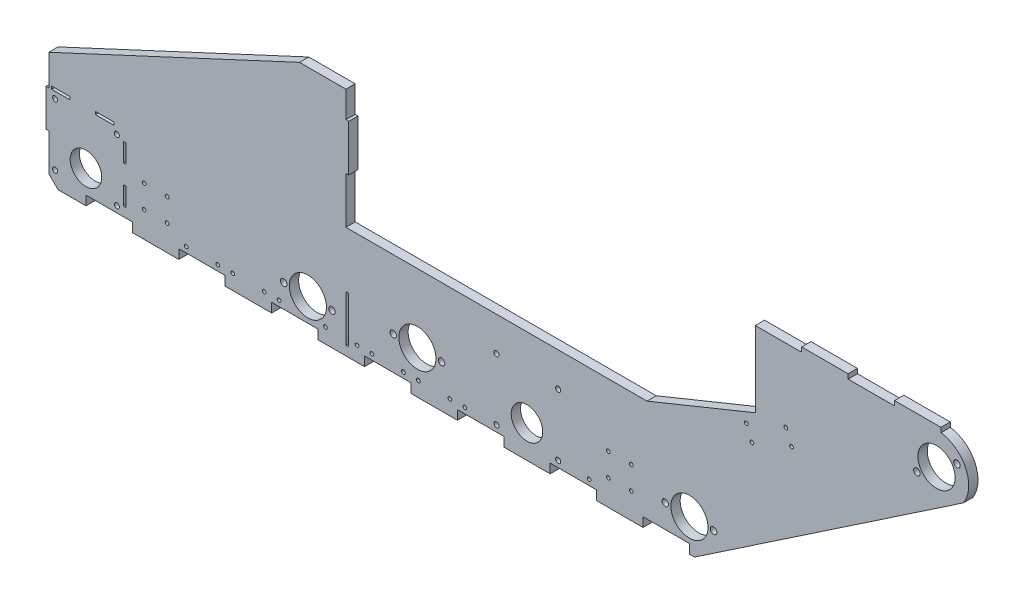
from build123d import *

# Parameters (mm, degrees)
SKETCH_1_R          = 2.75
SKETCH_1_R_2        = 17
SKETCH_1_R_3        = 20
SKETCH_1_R_4        = 3.5
SKETCH_1_R_5        = 2
SKETCH_1_W          = 20
SKETCH_1_H          = 3
SKETCH_1_W_2        = 3.160774411
SKETCH_1_H_2        = 20
SKETCH_1_W_3        = 3
SKETCH_1_H_3        = 50
EXTRUDE_1_DEPTH     = 10
EXTRUDE_3_DEPTH     = 10
SKETCH_3_R          = 2
CUT_EXTRUDE_1_DEPTH = 999.435971659


with BuildPart() as part:
    # 스케치1 → 보스-돌출1 (new body)
    with BuildSketch(Plane.XY):
        with BuildLine():
            Line((5.267585072, -97.655469737), (35.301603788, -97.655469737))
            Line((35.301603788, -97.655469737), (35.301603788, -87.655469737))
            Line((35.301603788, -87.655469737), (85.301603788, -87.655469737))
            Line((85.301603788, -87.655469737), (85.301603788, -97.655469737))
            Line((85.301603788, -97.655469737), (85.305622503, -97.655469737))
            Line((85.305622503, -97.655469737), (135.297585072, -97.655469737))
            Line((135.297585072, -97.655469737), (135.301603788, -97.655469737))
            Line((135.301603788, -97.655469737), (135.301603788, -87.655469737))
            Line((135.301603788, -87.655469737), (185.301603788, -87.655469737))
            Line((185.301603788, -87.655469737), (185.301603788, -97.655469737))
            Line((185.301603788, -97.655469737), (231.531603788, -97.655469737))
            Line((231.531603788, -97.655469737), (235.301603788, -97.655469737))
            Line((235.301603788, -97.655469737), (235.301603788, -87.655469737))
            Line((235.301603788, -87.655469737), (285.301603788, -87.655469737))
            Line((285.301603788, -87.655469737), (285.301603788, -97.655469737))
            Line((285.301603788, -97.655469737), (335.301603788, -97.655469737))
            Line((335.301603788, -97.655469737), (335.301603788, -87.655469737))
            Line((335.301603788, -87.655469737), (385.301603788, -87.655469737))
            Line((385.301603788, -87.655469737), (385.301603788, -97.655469737))
            Line((385.301603788, -97.655469737), (435.301603788, -97.655469737))
            Line((435.301603788, -97.655469737), (435.301603788, -87.655469737))
            Line((435.301603788, -87.655469737), (485.301603788, -87.655469737))
            Line((485.301603788, -87.655469737), (485.301603788, -97.655469737))
            Line((485.301603788, -97.655469737), (535.301603788, -97.655469737))
            Line((535.301603788, -97.655469737), (535.301603788, -87.655469737))
            Line((535.301603788, -87.655469737), (585.301603788, -87.655469737))
            Line((585.301603788, -87.655469737), (585.301603788, -97.655469737))
            Line((585.301603788, -97.655469737), (635.301603788, -97.655469737))
            Line((635.301603788, -97.655469737), (635.301603788, -87.655469737))
            Line((635.301603788, -87.655469737), (685.301603788, -87.655469737))
            Line((685.301603788, -87.655469737), (685.301603788, -97.655469737))
            Line((685.301603788, -97.655469737), (690.631109923, -97.655469737))
            Line((690.631109923, -97.655469737), (980.385244165, 97.7861616))
            ThreePointArc((980.385244165, 97.7861616), (983.008498199, 131.143098655), (956.214221814, 151.183893662))
            Line((956.214221814, 151.183893662), (639.593248415, 22.344530263))
            Line((639.593248415, 22.344530263), (315.301603788, 22.344530263))
            Line((315.301603788, 22.344530263), (315.301603788, 72.661637882))
            Line((315.301603788, 72.661637882), (318.301603788, 72.661637882))
            Line((318.301603788, 72.661637882), (318.301603788, 122.661637882))
            Line((318.301603788, 122.661637882), (315.301603788, 122.661637882))
            Line((315.301603788, 122.661637882), (315.301603788, 146.501001281))
            Line((315.301603788, 146.501001281), (315.301603788, 151.183893662))
            Line((315.301603788, 151.183893662), (265.299669923, 151.183893662))
            Line((265.299669923, 151.183893662), (-4.732414928, 25.58459835))
            Line((-4.732414928, 25.58459835), (-4.732414928, -7.689488453))
            Line((-4.732414928, -7.689488453), (-7.732414928, -7.689488453))
            Line((-7.732414928, -7.689488453), (-7.732414928, -47.689488453))
            Line((-7.732414928, -47.689488453), (-4.732414928, -47.689488453))
            Line((-4.732414928, -47.689488453), (-4.732414928, -87.655469737))
            Line((-4.732414928, -87.655469737), (5.267585072, -97.655469737))
        make_face()
        with Locations((2.067585072, -80.890469737)):
            Circle(SKETCH_1_R, mode=Mode.SUBTRACT)
        with Locations((2.067585072, -14.422432305)):
            Circle(SKETCH_1_R, mode=Mode.SUBTRACT)
        with Locations((68.535622503, -14.422432305)):
            Circle(SKETCH_1_R, mode=Mode.SUBTRACT)
        with Locations((68.535622503, -80.890469737)):
            Circle(SKETCH_1_R, mode=Mode.SUBTRACT)
        with Locations((35.301603788, -62.655469737)):
            Circle(SKETCH_1_R_2, mode=Mode.SUBTRACT)
        with Locations(Location((685.301603788, -62.655469737, 0), (0, 0, 180))):
            Circle(SKETCH_1_R_3, mode=Mode.SUBTRACT)
        with Locations((951.422664578, 116.845452277)):
            Circle(SKETCH_1_R_3, mode=Mode.SUBTRACT)
        with Locations((973.404213264, 130.731110971)):
            Circle(SKETCH_1_R_4, mode=Mode.SUBTRACT)
        with Locations((930.301497775, 101.683120237)):
            Circle(SKETCH_1_R_4, mode=Mode.SUBTRACT)
        with Locations((274.301603788, -62.655469737)):
            Circle(SKETCH_1_R_3, mode=Mode.SUBTRACT)
        with Locations((248.301603788, -62.655469737)):
            Circle(SKETCH_1_R_4, mode=Mode.SUBTRACT)
        with Locations((300.301603788, -62.655469737)):
            Circle(SKETCH_1_R_4, mode=Mode.SUBTRACT)
        with Locations((392.301603788, -51.655469737)):
            Circle(SKETCH_1_R_3, mode=Mode.SUBTRACT)
        with Locations((366.301603788, -51.655469737)):
            Circle(SKETCH_1_R_4, mode=Mode.SUBTRACT)
        with Locations((418.301603788, -51.655469737)):
            Circle(SKETCH_1_R_4, mode=Mode.SUBTRACT)
        with Locations(Location((543.898689933, -14.422432305, 0), (0, 0, 180))):
            Circle(SKETCH_1_R, mode=Mode.SUBTRACT)
        with Locations(Location((477.430652501, -14.422432305, 0), (0, 0, 180))):
            Circle(SKETCH_1_R, mode=Mode.SUBTRACT)
        with Locations(Location((477.430652501, -80.890469737, 0), (0, 0, 180))):
            Circle(SKETCH_1_R, mode=Mode.SUBTRACT)
        with Locations(Location((543.898689933, -80.890469737, 0), (0, 0, 180))):
            Circle(SKETCH_1_R, mode=Mode.SUBTRACT)
        with Locations(Location((510.301603788, -62.655469737, 0), (0, 0, 180))):
            Circle(SKETCH_1_R_2, mode=Mode.SUBTRACT)
        with Locations((659.301603788, -62.655469737)):
            Circle(SKETCH_1_R_4, mode=Mode.SUBTRACT)
        with Locations((711.301603788, -62.655469737)):
            Circle(SKETCH_1_R_4, mode=Mode.SUBTRACT)
        with Locations((143.301603788, -81.655469737)):
            Circle(SKETCH_1_R_5, mode=Mode.SUBTRACT)
        with Locations((177.301603788, -81.655469737)):
            Circle(SKETCH_1_R_5, mode=Mode.SUBTRACT)
        with Locations((193.301603788, -81.655469737)):
            Circle(SKETCH_1_R_5, mode=Mode.SUBTRACT)
        with Locations((227.301603788, -81.655469737)):
            Circle(SKETCH_1_R_5, mode=Mode.SUBTRACT)
        with Locations((243.301603788, -81.655469737)):
            Circle(SKETCH_1_R_5, mode=Mode.SUBTRACT)
        with Locations((293.301603788, -81.655469737)):
            Circle(SKETCH_1_R_5, mode=Mode.SUBTRACT)
        with Locations((327.301603788, -81.655469737)):
            Circle(SKETCH_1_R_5, mode=Mode.SUBTRACT)
        with Locations((343.301603788, -81.655469737)):
            Circle(SKETCH_1_R_5, mode=Mode.SUBTRACT)
        with Locations((377.301603788, -81.655469737)):
            Circle(SKETCH_1_R_5, mode=Mode.SUBTRACT)
        with Locations((393.301603788, -81.655469737)):
            Circle(SKETCH_1_R_5, mode=Mode.SUBTRACT)
        with Locations((427.301603788, -81.655469737)):
            Circle(SKETCH_1_R_5, mode=Mode.SUBTRACT)
        with Locations((443.301603788, -81.655469737)):
            Circle(SKETCH_1_R_5, mode=Mode.SUBTRACT)
        with Locations((577.301603788, -81.655469737)):
            Circle(SKETCH_1_R_5, mode=Mode.SUBTRACT)
        with Locations((97.927235117, -45.281101066)):
            Circle(SKETCH_1_R_5, mode=Mode.SUBTRACT)
        with Locations(Location((122.675972458, -45.281101066, 0), (0, 0, 180))):
            Circle(SKETCH_1_R_5, mode=Mode.SUBTRACT)
        with Locations((122.675972458, -70.029838408)):
            Circle(SKETCH_1_R_5, mode=Mode.SUBTRACT)
        with Locations(Location((97.927235117, -70.029838408, 0), (0, 0, 180))):
            Circle(SKETCH_1_R_5, mode=Mode.SUBTRACT)
        with Locations((597.927235117, -45.281101066)):
            Circle(SKETCH_1_R_5, mode=Mode.SUBTRACT)
        with Locations(Location((622.675972458, -45.281101066, 0), (0, 0, 180))):
            Circle(SKETCH_1_R_5, mode=Mode.SUBTRACT)
        with Locations((622.675972458, -70.029838408)):
            Circle(SKETCH_1_R_5, mode=Mode.SUBTRACT)
        with Locations(Location((597.927235117, -70.029838408, 0), (0, 0, 180))):
            Circle(SKETCH_1_R_5, mode=Mode.SUBTRACT)
        with Locations((8.301603788, -5.922432305)):
            Rectangle(SKETCH_1_W, SKETCH_1_H, mode=Mode.SUBTRACT)
        with Locations((55.535622503, -5.922432305)):
            Rectangle(SKETCH_1_W, SKETCH_1_H, mode=Mode.SUBTRACT)
        with Locations((77.116009709, -27.422432305)):
            Rectangle(SKETCH_1_W_2, SKETCH_1_H_2, mode=Mode.SUBTRACT)
        with Locations((77.116009709, -67.655469737)):
            Rectangle(SKETCH_1_W_2, SKETCH_1_H_2, mode=Mode.SUBTRACT)
        with Locations((316.801603788, -62.655469737)):
            Rectangle(SKETCH_1_W_3, SKETCH_1_H_3, mode=Mode.SUBTRACT)
    extrude(amount=EXTRUDE_1_DEPTH)

    # 스케치2 → 보스-돌출3 (add)
    with BuildSketch(Plane.XY.offset(10)):
        Polygon((756.214221814, 151.183893662), (756.214221814, 69.799920885), (956.214221814, 151.183893662), (956.214221814, 156.183893662), (906.214221814, 156.183893662), (906.214221814, 151.183893662), (856.214221814, 151.183893662), (856.214221814, 156.183893662), (806.214221814, 156.183893662), (806.214221814, 151.183893662), align=None)
    extrude(amount=-EXTRUDE_3_DEPTH)

    # 스케치3 → 컷-돌출1 (cut, through all)
    with BuildSketch(Plane.XY.offset(10)):
        with Locations((746.563195632, 55.162355864)):
            Circle(SKETCH_3_R)
        with Locations((752.593781974, 40.342368402)):
            Circle(SKETCH_3_R)
        with Locations((789.170659585, 72.500291597)):
            Circle(SKETCH_3_R)
        with Locations((795.201245927, 57.680304135)):
            Circle(SKETCH_3_R)
    extrude(amount=-CUT_EXTRUDE_1_DEPTH, mode=Mode.SUBTRACT)


solid = part.part
